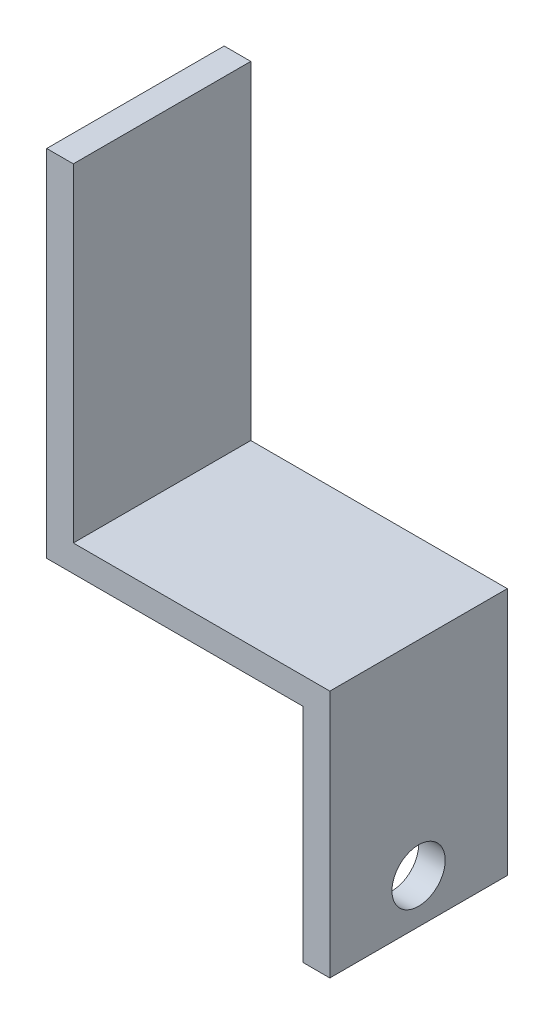
from build123d import *

# Parameters (mm, degrees)
BOSS_EXTRUDE1_DEPTH = 20
SKETCH3_R           = 3
CUT_EXTRUDE2_DEPTH  = 3


with BuildPart() as part:
    # Sketch1 → Boss-Extrude1 (new body)
    with BuildSketch(Plane.XY):
        Polygon((0, 0), (0, -27.999047944), (-3, -27.999047944), (-3, -2.999047944), (-31.907622925, -2.999047944), (-31.907622925, 37.000952056), (-28.907622925, 37.000952056), (-28.907622925, 0), align=None)
    extrude(amount=BOSS_EXTRUDE1_DEPTH)

    # Sketch3 → Cut-Extrude2 (cut)
    with BuildSketch(Plane(origin=(0, 0, 0), x_dir=(0, 0, -1), z_dir=(1, 0, 0))):
        with Locations(Location((-10, -22.999047944, 0), (0, 0, 90))):
            Circle(SKETCH3_R)
    extrude(amount=-CUT_EXTRUDE2_DEPTH, mode=Mode.SUBTRACT)


solid = part.part
